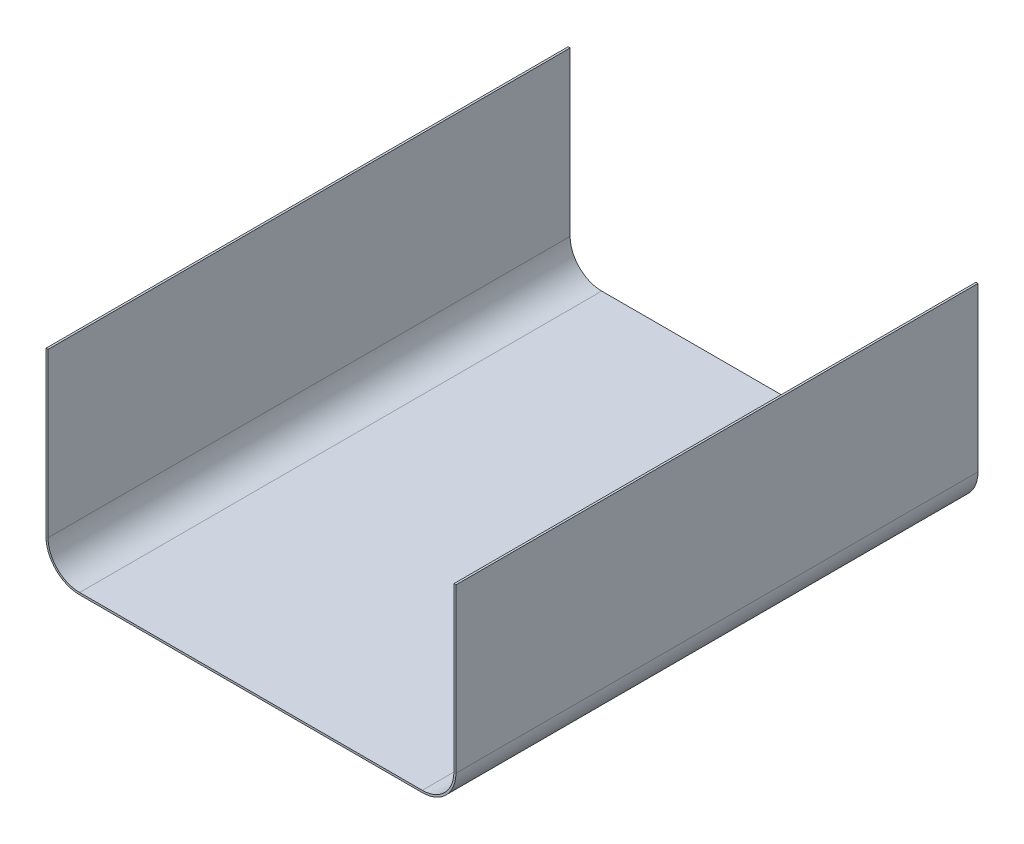
from build123d import *

# Parameters (mm, degrees)
BOSS_EXTRUDE1_DEPTH = 406.4


with BuildPart() as part:
    # Sketch1 → Boss-Extrude1 (new body)
    with BuildSketch(Plane.XY):
        with BuildLine():
            Line((0.79375, 0), (0, 0))
            Line((0, 0), (0, -127))
            ThreePointArc((0, -127), (7.439487758, -144.960512242), (25.4, -152.4))
            Line((25.4, -152.4), (292.1, -152.4))
            ThreePointArc((292.1, -152.4), (310.060512242, -144.960512242), (317.5, -127))
            Line((317.5, -127), (317.5, 0))
            Line((317.5, 0), (316.70625, 0))
            Line((316.70625, 0), (316.70625, -127))
            ThreePointArc((316.70625, -127), (309.499246235, -144.399246235), (292.1, -151.60625))
            Line((292.1, -151.60625), (25.4, -151.60625))
            ThreePointArc((25.4, -151.60625), (8.000753765, -144.399246235), (0.79375, -127))
            Line((0.79375, -127), (0.79375, 0))
        make_face()
        with BuildLine():
            Line((0, -127), (0, 0))
            Line((0, 0), (-0.79375, 0))
            Line((-0.79375, 0), (-0.79375, -127))
            ThreePointArc((-0.79375, -127), (6.87822175, -145.52177825), (25.4, -153.19375))
            Line((25.4, -153.19375), (292.1, -153.19375))
            ThreePointArc((292.1, -153.19375), (310.62177825, -145.52177825), (318.29375, -127))
            Line((318.29375, -127), (318.29375, 0))
            Line((318.29375, 0), (317.5, 0))
            Line((317.5, 0), (317.5, -127))
            ThreePointArc((317.5, -127), (310.060512242, -144.960512242), (292.1, -152.4))
            Line((292.1, -152.4), (25.4, -152.4))
            ThreePointArc((25.4, -152.4), (7.439487758, -144.960512242), (0, -127))
        make_face()
    extrude(amount=BOSS_EXTRUDE1_DEPTH)


solid = part.part
